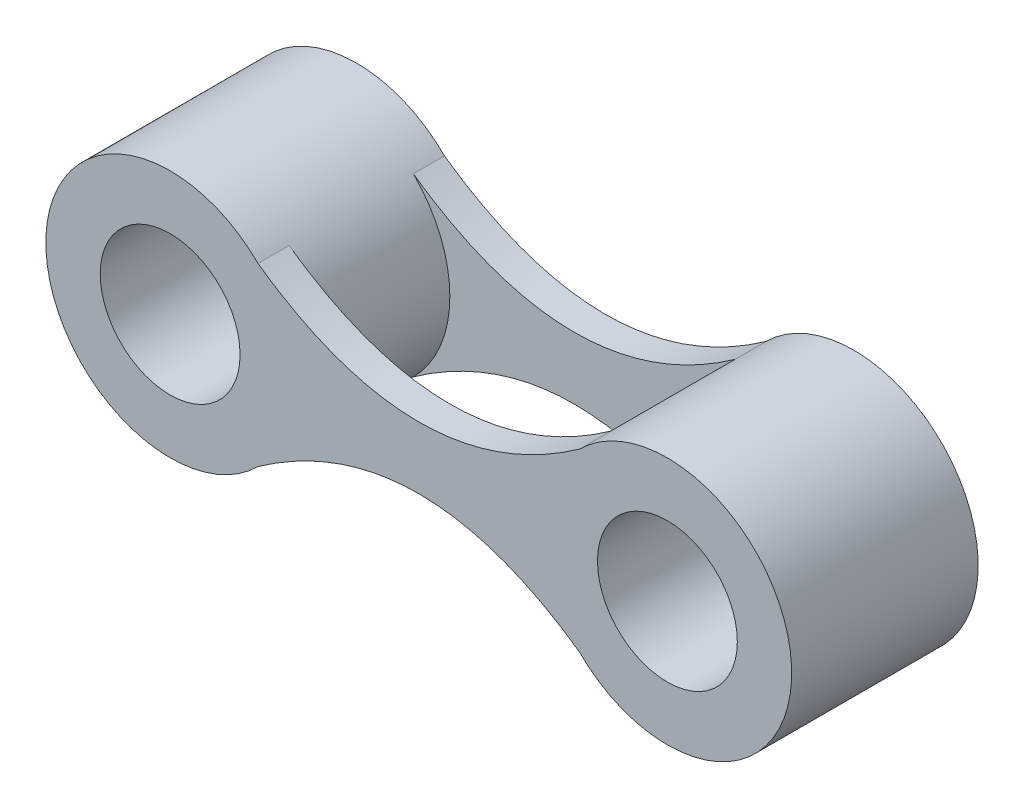
from build123d import *

# Parameters (mm, degrees)
BOSS_EXTRUDE1_DEPTH = 0.79375
SKETCH2_R           = 3.175
BOSS_EXTRUDE2_DEPTH = 3.175
SKETCH3_R           = 1.7859375
CUT_EXTRUDE1_DEPTH  = 6.35


with BuildPart() as part:
    # Sketch1 → Boss-Extrude1 (new body)
    with BuildSketch(Plane.XY):
        with BuildLine():
            ThreePointArc((-4.10493597, 2.24506403), (-9.525, 0), (-4.10493597, -2.24506403))
            add(Edge.make_bspline(
                [(-4.10493597, -2.24506403), (0, 0.65756403), (4.10493597, -2.24506403)],
                knots=[0, 0, 0, 1, 1, 1], degree=2))
            ThreePointArc((4.10493597, -2.24506403), (9.525, 0), (4.10493597, 2.24506403))
            add(Edge.make_bspline(
                [(-4.10493597, 2.24506403), (0, -0.65756403), (4.10493597, 2.24506403)],
                knots=[0, 0, 0, 1, 1, 1], degree=2))
        make_face()
    boss_extrude1 = extrude(amount=BOSS_EXTRUDE1_DEPTH)

    # Sketch2 → Boss-Extrude2 (add)
    with BuildSketch(Plane.XY.offset(0.79375)):
        with Locations(Location((-6.35, 0, 0), (0, 0, 315))):
            Circle(SKETCH2_R)
        with Locations(Location((6.35, 0, 0), (0, 0, 135))):
            Circle(SKETCH2_R)
    extrude(amount=BOSS_EXTRUDE2_DEPTH)

    # Mirror1: Boss-Extrude1 across plane
    add(boss_extrude1.mirror(Plane.XY.offset(2.38125)))

    # Sketch3 → Cut-Extrude1 (cut)
    with BuildSketch(Plane(origin=(0, 0, 0), x_dir=(-1, 0, 0), z_dir=(0, 0, -1))):
        with Locations((-6.35, 0)):
            Circle(SKETCH3_R)
        with Locations((6.35, 0)):
            Circle(SKETCH3_R)
    extrude(amount=-CUT_EXTRUDE1_DEPTH, mode=Mode.SUBTRACT)


solid = part.part
